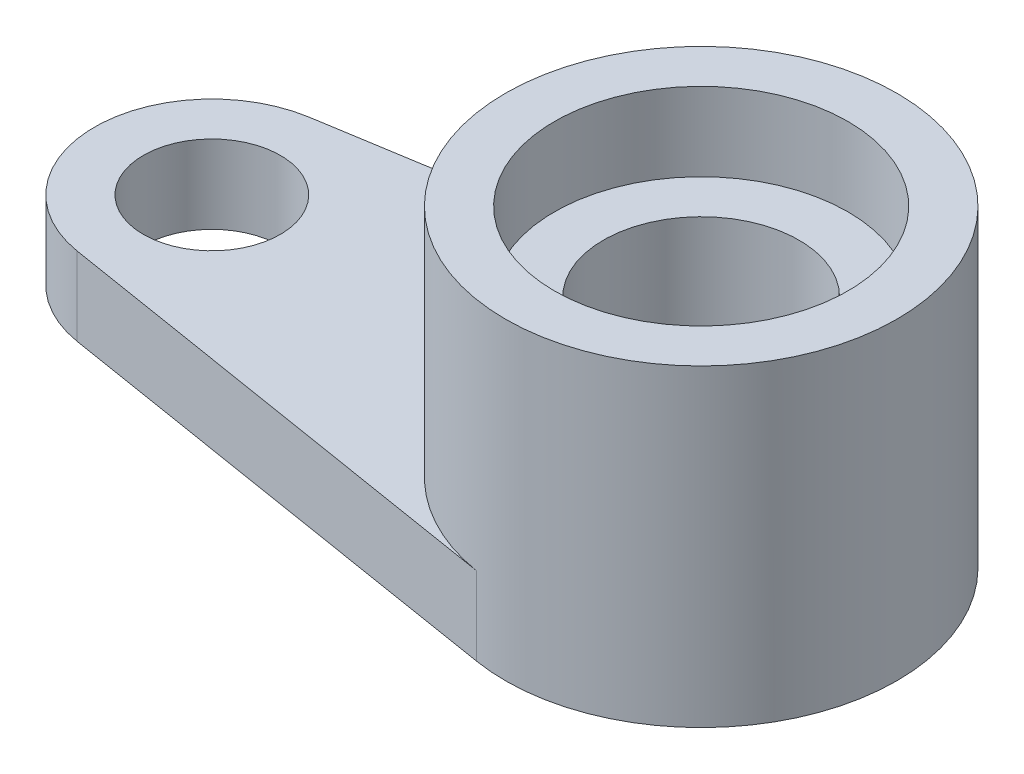
from build123d import *

# Parameters (mm, degrees)
EXTRUDE_3_DEPTH     = 8
SKETCH_5_R          = 20
EXTRUDE_4_DEPTH     = 32
SKETCH_7_R          = 15
CUT_EXTRUDE_1_DEPTH = 8
SKETCH_8_R          = 10
CUT_EXTRUDE_2_DEPTH = 38
SKETCH_9_R          = 7
CUT_EXTRUDE_4_DEPTH = 18


with BuildPart() as part:
    # 草图2 → 凸台-拉伸3 (new body)
    with BuildSketch(Plane(origin=(0, 0, 0), x_dir=(1, 0, 0), z_dir=(0, 1, 0))):
        with BuildLine():
            Line((-3.2, 19.742340287), (-51.92, 11.845404172))
            ThreePointArc((-51.92, 11.845404172), (-62, 0), (-51.92, -11.845404172))
            Line((-51.92, -11.845404172), (-3.2, -19.742340287))
            ThreePointArc((-3.2, -19.742340287), (20, 0), (-3.2, 19.742340287))
        make_face()
    extrude(amount=EXTRUDE_3_DEPTH)

    # 草图5 → 凸台-拉伸4 (add)
    with BuildSketch(Plane(origin=(0, 0, 0), x_dir=(1, 0, 0), z_dir=(0, 1, 0))):
        with Locations(Location((0, 0, 0), (0, 0, 99.206896221))):
            Circle(SKETCH_5_R)
    extrude(amount=EXTRUDE_4_DEPTH)

    # 草图7 → 切除-拉伸1 (cut)
    with BuildSketch(Plane(origin=(0, 32, 0), x_dir=(1, 0, 0), z_dir=(0, 1, 0))):
        with Locations(Location((0, 0, 0), (0, 0, 270))):
            Circle(SKETCH_7_R)
    extrude(amount=-CUT_EXTRUDE_1_DEPTH, mode=Mode.SUBTRACT)

    # 草图8 → 切除-拉伸2 (cut)
    with BuildSketch(Plane(origin=(0, 0, 0), x_dir=(1, 0, 0), z_dir=(0, 1, 0))):
        with Locations(Location((0, 0, 0), (0, 0, 270))):
            Circle(SKETCH_8_R)
    extrude(amount=CUT_EXTRUDE_2_DEPTH, mode=Mode.SUBTRACT)

    # 草图9 → 切除-拉伸4 (cut)
    with BuildSketch(Plane(origin=(0, 0, 0), x_dir=(1, 0, 0), z_dir=(0, 1, 0))):
        with Locations(Location((-50, 0, 0), (0, 0, 270))):
            Circle(SKETCH_9_R)
    extrude(amount=CUT_EXTRUDE_4_DEPTH, mode=Mode.SUBTRACT)


solid = part.part
